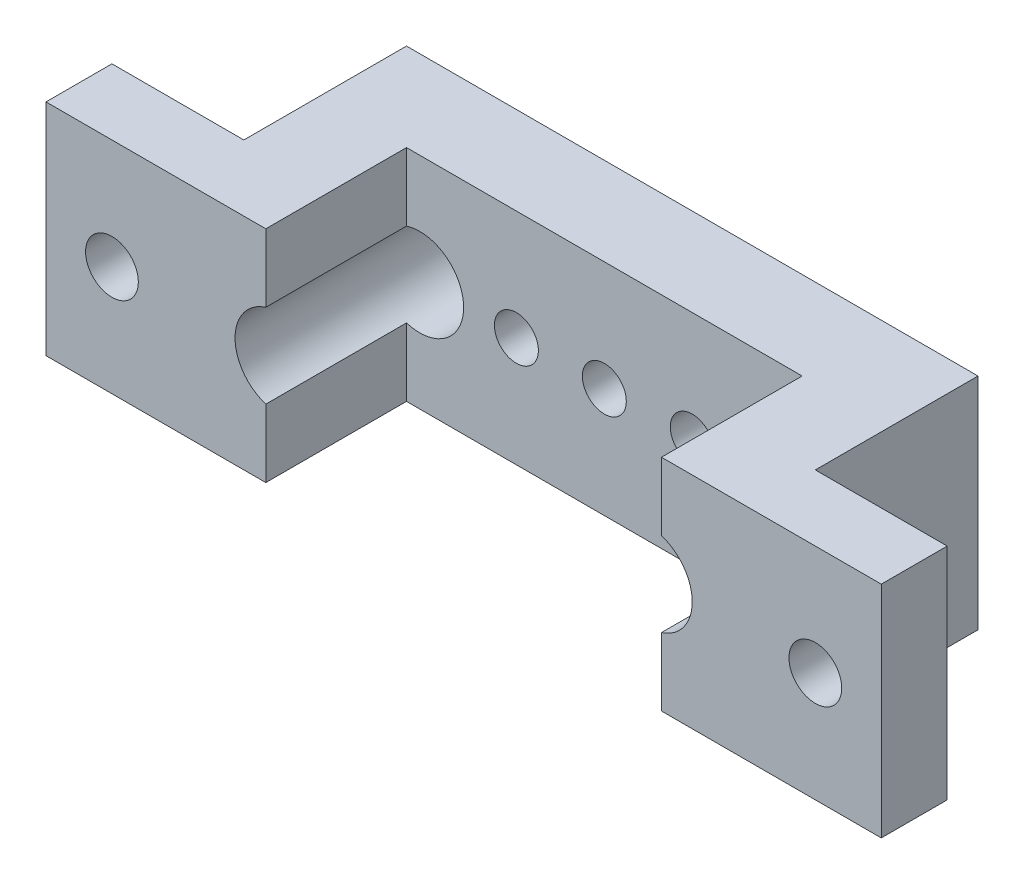
from build123d import *

# Parameters (mm, degrees)
SKETCH_1_R      = 0.5
EXTRUDE_1_DEPTH = 2
EXTRUDE_2_DEPTH = 5.2
EXTRUDE_START   = 5.2
SKETCH_1_13_W   = 3
SKETCH_1_13_H   = 5
SKETCH_1_13_R   = 0.6
EXTRUDE_3_DEPTH = 1.5


with BuildPart() as part:
    # 草图1 → 凸台-拉伸1 (new body)
    with BuildSketch(Plane.XY):
        with BuildLine():
            Line((4.5, 2.5), (-4.5, 2.5))
            Line((-4.5, 2.5), (-4.5, 0.953939201))
            ThreePointArc((-4.5, 0.953939201), (-3.608392022, 0.806225775), (-3.2, 0))
            ThreePointArc((-3.2, 0), (-3.608392022, -0.806225775), (-4.5, -0.953939201))
            Line((-4.5, -0.953939201), (-4.5, -2.5))
            Line((-4.5, -2.5), (4.5, -2.5))
            Line((4.5, -2.5), (4.5, -0.953939201))
            ThreePointArc((4.5, -0.953939201), (3.2, 0), (4.5, 0.953939201))
            Line((4.5, 0.953939201), (4.5, 2.5))
        make_face()
        with BuildLine():
            ThreePointArc((2.5, 0), (2, -0.5), (1.5, 0))
            ThreePointArc((1.5, 0), (2, 0.5), (2.5, 0))
        make_face(mode=Mode.SUBTRACT)
        with Locations((-2, 0)):
            Circle(SKETCH_1_R, mode=Mode.SUBTRACT)
        with BuildLine():
            ThreePointArc((0.5, 0), (0, -0.5), (-0.5, 0))
            ThreePointArc((-0.5, 0), (0, 0.5), (0.5, 0))
        make_face(mode=Mode.SUBTRACT)
    extrude(amount=EXTRUDE_1_DEPTH)

    # 草图1<10> → 凸台-拉伸2 (add)
    with BuildSketch(Plane.XY):
        with BuildLine():
            Line((-4.5, 0.953939201), (-4.5, 2.5))
            Line((-4.5, 2.5), (-6.5, 2.5))
            Line((-6.5, 2.5), (-6.5, -2.5))
            Line((-6.5, -2.5), (-4.5, -2.5))
            Line((-4.5, -2.5), (-4.5, -0.953939201))
            ThreePointArc((-4.5, -0.953939201), (-5.2, 0), (-4.5, 0.953939201))
        make_face()
        with BuildLine():
            Line((6.5, 2.5), (4.5, 2.5))
            Line((4.5, 2.5), (4.5, 0.953939201))
            ThreePointArc((4.5, 0.953939201), (5.2, 0), (4.5, -0.953939201))
            Line((4.5, -0.953939201), (4.5, -2.5))
            Line((4.5, -2.5), (6.5, -2.5))
            Line((6.5, -2.5), (6.5, 2.5))
        make_face()
    extrude(amount=EXTRUDE_2_DEPTH)

    # 草图1<13> → 凸台-拉伸3 (add)
    # profile 1 of 2: a face of its own
    with BuildSketch(Plane.XY.offset(EXTRUDE_START)):
        with Locations((-8, 0)):
            Rectangle(SKETCH_1_13_W, SKETCH_1_13_H)
        with Locations((-8, 0)):
            Circle(SKETCH_1_13_R, mode=Mode.SUBTRACT)
    # profile 2 of 2: a face of its own
    with BuildSketch(Plane.XY.offset(EXTRUDE_START)):
        with Locations((8, 0)):
            Rectangle(SKETCH_1_13_W, SKETCH_1_13_H)
        with Locations((8, 0)):
            Circle(SKETCH_1_13_R, mode=Mode.SUBTRACT)
    extrude(amount=-EXTRUDE_3_DEPTH)


solid = part.part
